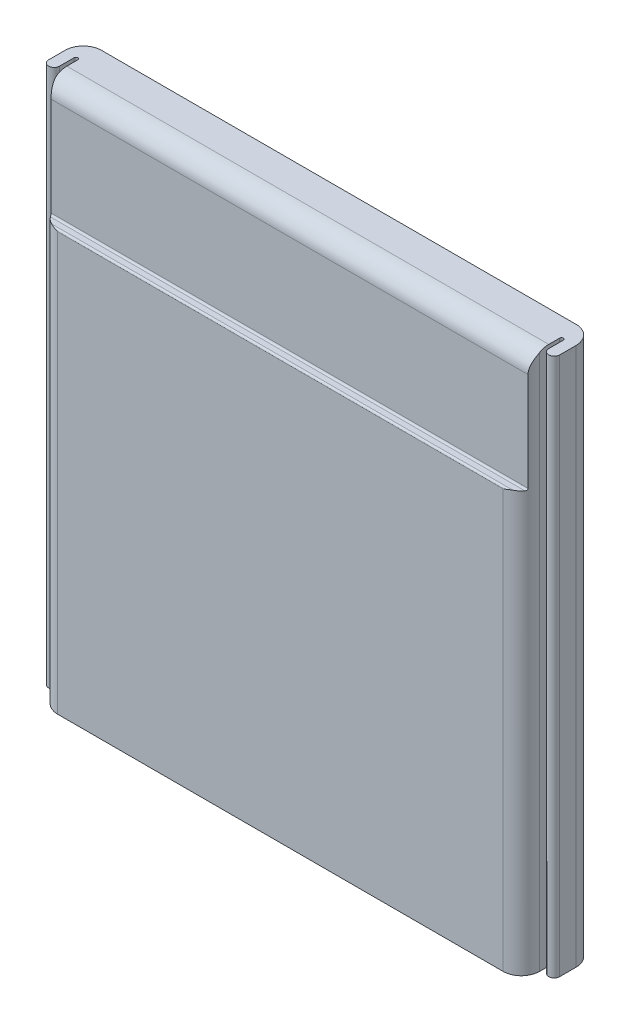
from build123d import *

# Parameters (mm, degrees)
EXTRUDE_1_DEPTH                 = 14.75
CUT_EXTRUDE_1_REACH             = 22.586
CUT_EXTRUDE_1_DIRECTION_2_REACH = 22.586


with BuildPart() as part:
    # Эскиз1 → Бобышка-Вытянуть1 (new, symmetric)
    with BuildSketch(Plane(origin=(0, 0, 0), x_dir=(1, 0, 0), z_dir=(0, 1, 0))):
        with BuildLine():
            Line((-13, 0), (13, 0))
            ThreePointArc((13, 0), (13.707106781, -0.292893219), (14, -1))
            Line((14, -1), (14, -1.9))
            ThreePointArc((14, -1.9), (13.7, -2.2), (13.4, -1.9))
            Line((13.4, -1.9), (13.4, -1.1))
            ThreePointArc((13.4, -1.1), (13.3, -1), (13.2, -1.1))
            Line((13.2, -1.1), (13.2, -2.2))
            ThreePointArc((13.2, -2.2), (12.907106781, -2.907106781), (12.2, -3.2))
            Line((12.2, -3.2), (-12.2, -3.2))
            ThreePointArc((-12.2, -3.2), (-12.907106781, -2.907106781), (-13.2, -2.2))
            Line((-13.2, -2.2), (-13.2, -1.1))
            ThreePointArc((-13.2, -1.1), (-13.3, -1), (-13.4, -1.1))
            Line((-13.4, -1.1), (-13.4, -1.9))
            ThreePointArc((-13.4, -1.9), (-13.7, -2.2), (-14, -1.9))
            Line((-14, -1.9), (-14, -1))
            ThreePointArc((-14, -1), (-13.707106781, -0.292893219), (-13, 0))
        make_face()
    extrude(amount=EXTRUDE_1_DEPTH, both=True)

    # Эскиз2 → Вырез-Вытянуть1 (cut, up to next)
    with BuildSketch(Plane(origin=(0, 0, 0), x_dir=(0, 0, -1), z_dir=(1, 0, 0)), mode=Mode.PRIVATE) as cut_extrude_1_sk1:
        with BuildLine():
            Line((-2.7, 13.75), (-2.7, 8.35))
            ThreePointArc((-2.7, 8.35), (-2.729289322, 8.279289322), (-2.8, 8.25))
            Line((-2.8, 8.25), (-3.1, 8.25))
            ThreePointArc((-3.1, 8.25), (-3.170710678, 8.220710678), (-3.2, 8.15))
            Line((-3.2, 8.15), (-3.2, 14.75))
            Line((-3.2, 14.75), (-1.7, 14.75))
            ThreePointArc((-1.7, 14.75), (-2.407106781, 14.457106781), (-2.7, 13.75))
        make_face()
    cut_extrude_1_tool1 = extrude(cut_extrude_1_sk1.sketch, amount=-CUT_EXTRUDE_1_REACH, mode=Mode.PRIVATE) & part.part
    add(cut_extrude_1_tool1.solids().sort_by_distance((0, 11.687446, 2.920961))[0], mode=Mode.SUBTRACT)

    # Эскиз2 → Вырез-Вытянуть1 direction 2 (cut, up to next)
    with BuildSketch(Plane(origin=(0, 0, 0), x_dir=(0, 0, -1), z_dir=(1, 0, 0)), mode=Mode.PRIVATE) as cut_extrude_1_direction_2_sk1:
        with BuildLine():
            Line((-2.7, 13.75), (-2.7, 8.35))
            ThreePointArc((-2.7, 8.35), (-2.729289322, 8.279289322), (-2.8, 8.25))
            Line((-2.8, 8.25), (-3.1, 8.25))
            ThreePointArc((-3.1, 8.25), (-3.170710678, 8.220710678), (-3.2, 8.15))
            Line((-3.2, 8.15), (-3.2, 14.75))
            Line((-3.2, 14.75), (-1.7, 14.75))
            ThreePointArc((-1.7, 14.75), (-2.407106781, 14.457106781), (-2.7, 13.75))
        make_face()
    cut_extrude_1_direction_2_tool1 = extrude(cut_extrude_1_direction_2_sk1.sketch, amount=CUT_EXTRUDE_1_DIRECTION_2_REACH, mode=Mode.PRIVATE) & part.part
    add(cut_extrude_1_direction_2_tool1.solids().sort_by_distance((0, 11.687446, 2.920961))[0], mode=Mode.SUBTRACT)


solid = part.part
